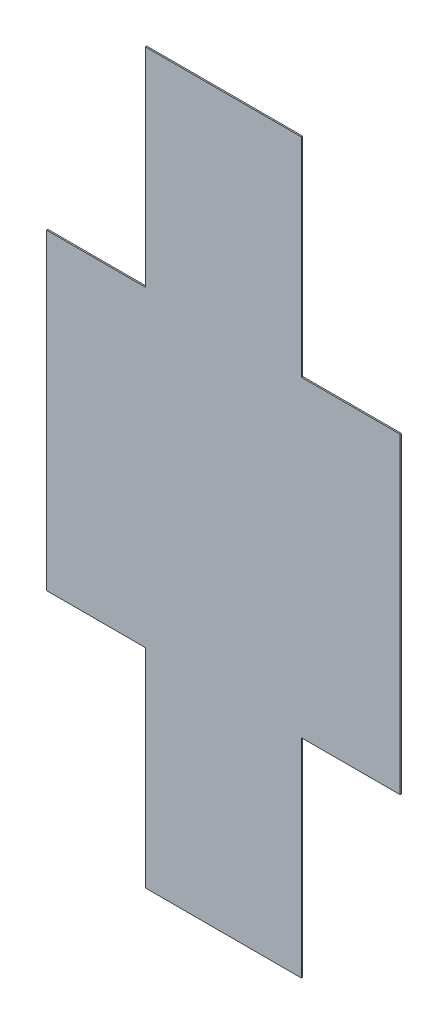
from build123d import *

# Parameters (mm, degrees)
SKETCH_1_W          = 76
SKETCH_1_H          = 70
EXTRUDE_1_DEPTH     = 0.13
CUT_EXTRUDE_1_DEPTH = 52.662528974


with BuildPart() as part:
    # 草圖1 → 填料-伸長1 (new body)
    with BuildSketch(Plane.XY):
        Rectangle(SKETCH_1_W, SKETCH_1_H)
    extrude(amount=EXTRUDE_1_DEPTH)

    # 草圖2 → 除料-伸長1 (cut, through all)
    with BuildSketch(Plane.XY.offset(0.13)):
        Polygon((-38, 35), (-7.5, 35), (-7.5, 15), (-17, 15), (-17, -15), (-7.5, -15), (-7.5, -35), (-38, -35), align=None)
        Polygon((17, 15), (7.5, 15), (7.5, 35), (38, 35), (38, -35), (7.5, -35), (7.5, -15), (17, -15), align=None)
    extrude(amount=-CUT_EXTRUDE_1_DEPTH, mode=Mode.SUBTRACT)


solid = part.part
